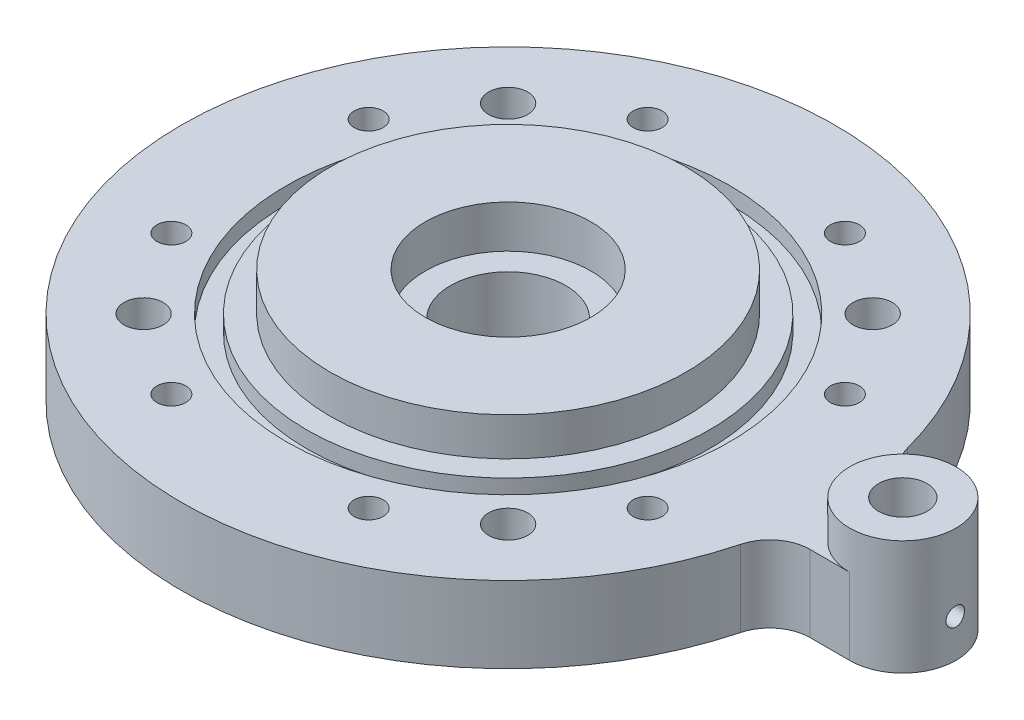
from build123d import *

# Parameters (mm, degrees)
BASE_DEPTH                       = 13.175
SKETCH3_R                        = 3.373437
SKETCH3_R_2                      = 3.373438
SQUARE_BOLT_HOLES_DEPTH          = 97.509984
SKETCH4_R                        = 2.5
HOUSING_BOLTS_DEPTH              = 44.33
CIRPATTERN1_COUNT                = 8
SKETCH2_R                        = 30.6705
SKETCH2_R_2                      = 9.167187
SKETCH2_R_3                      = 4.167187
IMPELLER_CAVITY_RISER_DEPTH      = 6.59
SKETCH5_R                        = 14.2875
SEAL_BORE_DEPTH                  = 7.35
SKETCH6_R                        = 9.9375
BORE_DEPTH                       = 39.3
PRESSURE_TAP_DEPTH               = 128.557006
PRESSURE_TAP_DEPTH_BACK          = 56.35625
SKETCH9_R                        = 1.5875
SKETCH10_R                       = 1.5875
PRESSURE_TAP_VERTICAL_HOLE_DEPTH = 8.175
SKETCH12_R                       = 38.2524
SKETCH12_R_2                     = 34.7218
CUT_EXTRUDE1_DEPTH               = 2.82448


with BuildPart() as part:
    # Sketch1 → base (new body)
    with BuildSketch(Plane(origin=(0, 0, 0), x_dir=(1, 0, 0), z_dir=(0, 1, 0))):
        with BuildLine():
            Line((61.258766, 9.167187), (68.063437, 9.167187))
            ThreePointArc((68.063437, 9.167187), (77.230625, 0), (68.063437, -9.167187))
            Line((68.063437, -9.167187), (61.258766, -9.167187))
            ThreePointArc((61.258766, -9.167187), (56.986985, -10.621749), (54.49051, -14.380934))
            ThreePointArc((54.49051, -14.380934), (-56.35625, 0), (54.49051, 14.380934))
            ThreePointArc((54.49051, 14.380934), (56.986985, 10.621749), (61.258766, 9.167187))
        make_face()
    extrude(amount=BASE_DEPTH)

    # Sketch3 → square bolt holes (cut, through all)
    with BuildSketch(Plane.XZ):
        with Locations(Location((-31.430896, -31.430896, 0), (0, 0, 270))):
            Circle(SKETCH3_R)
        with Locations(Location((-31.430896, 31.430896, 0), (0, 0, 270))):
            Circle(SKETCH3_R)
        with Locations(Location((31.430896, 31.430896, 0), (0, 0, 270))):
            Circle(SKETCH3_R_2)
        with Locations(Location((31.430896, -31.430896, 0), (0, 0, 270))):
            Circle(SKETCH3_R_2)
    extrude(amount=-SQUARE_BOLT_HOLES_DEPTH, mode=Mode.SUBTRACT)

    # Sketch4 → housing bolts (cut)
    with BuildSketch(Plane(origin=(0, 13.175, 0), x_dir=(1, 0, 0), z_dir=(0, 1, 0))):
        with Locations(Location((17.010279, 41.066445, 0), (0, 0, 270))):
            Circle(SKETCH4_R)
    housing_bolts = extrude(amount=-HOUSING_BOLTS_DEPTH, mode=Mode.SUBTRACT)

    # CirPattern1: housing bolts ×8 about axis
    cirpattern1_axis = Axis((0, 0, 0), (0, 1, 0))
    for i in range(1, CIRPATTERN1_COUNT):
        add(housing_bolts.rotate(cirpattern1_axis, i * 360 / CIRPATTERN1_COUNT), mode=Mode.SUBTRACT)

    # Sketch2 → impeller cavity riser (add)
    # profile 1 of 2: a face of its own
    with BuildSketch(Plane(origin=(0, 13.175, 0), x_dir=(1, 0, 0), z_dir=(0, 1, 0))):
        with Locations(Location((0, 0, 0), (0, 0, 270))):
            Circle(SKETCH2_R)
    # profile 2 of 2: a face of its own
    with BuildSketch(Plane(origin=(0, 13.175, 0), x_dir=(1, 0, 0), z_dir=(0, 1, 0))):
        with Locations(Location((68.063437, 0, 0), (0, 0, 270))):
            Circle(SKETCH2_R_2)
        with Locations(Location((68.063437, 0, 0), (0, 0, 270))):
            Circle(SKETCH2_R_3, mode=Mode.SUBTRACT)
    extrude(amount=IMPELLER_CAVITY_RISER_DEPTH)

    # Sketch5 → seal bore (cut)
    with BuildSketch(Plane(origin=(0, 19.765, 0), x_dir=(1, 0, 0), z_dir=(0, 1, 0))):
        with Locations(Location((0, 0, 0), (0, 0, 270))):
            Circle(SKETCH5_R)
    extrude(amount=-SEAL_BORE_DEPTH, mode=Mode.SUBTRACT)

    # Sketch6 → bore (cut)
    with BuildSketch(Plane(origin=(0, 12.415, 0), x_dir=(1, 0, 0), z_dir=(0, 1, 0))):
        with Locations(Location((0, 0, 0), (0, 0, 270))):
            Circle(SKETCH6_R)
    extrude(amount=-BORE_DEPTH, mode=Mode.SUBTRACT)

    # Sketch9 → pressure tap (cut, two sides: drawn at the far end of the back side and taken through both)
    with BuildSketch(Plane(origin=(56.35625, 0, 0), x_dir=(0, 0, -1), z_dir=(1, 0, 0)).offset(-PRESSURE_TAP_DEPTH_BACK)):
        with Locations(Location((0, 6.5875, 0), (0, 0, 180))):
            Circle(SKETCH9_R)
    extrude(amount=PRESSURE_TAP_DEPTH + PRESSURE_TAP_DEPTH_BACK, mode=Mode.SUBTRACT)

    # Sketch10 → pressure tap vertical hole (cut)
    with BuildSketch(Plane(origin=(0, 13.175, 0), x_dir=(1, 0, 0), z_dir=(0, 1, 0))):
        with Locations(Location((68.063437, 0, 0), (0, 0, 270))):
            Circle(SKETCH10_R)
    extrude(amount=-PRESSURE_TAP_VERTICAL_HOLE_DEPTH, mode=Mode.SUBTRACT)

    # Sketch12 → Cut-Extrude1 (cut)
    with BuildSketch(Plane(origin=(0, 13.175, 0), x_dir=(1, 0, 0), z_dir=(0, 1, 0))):
        with Locations(Location((0, 0, 0), (0, 0, 270))):
            Circle(SKETCH12_R)
        with Locations(Location((0, 0, 0), (0, 0, 270))):
            Circle(SKETCH12_R_2, mode=Mode.SUBTRACT)
    extrude(amount=-CUT_EXTRUDE1_DEPTH, mode=Mode.SUBTRACT)


solid = part.part
